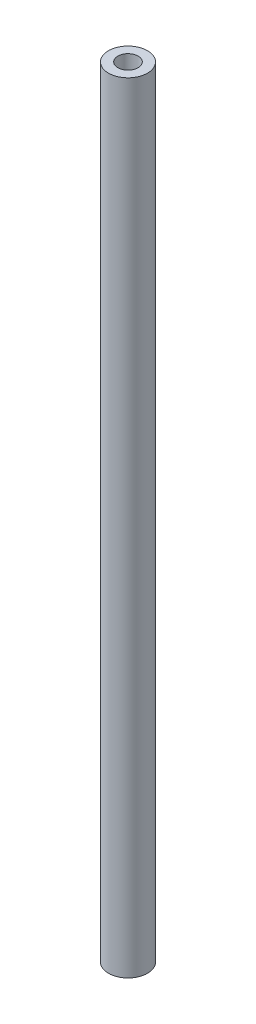
from build123d import *

# Parameters (mm, degrees)
SKETCH1_R           = 5
BOSS_EXTRUDE1_DEPTH = 200
SKETCH2_R           = 2.6
CUT_EXTRUDE1_DEPTH  = 10
CUT_EXTRUDE2_START  = -10
SKETCH3_R           = 2.6
CUT_EXTRUDE2_DEPTH  = 10


with BuildPart() as part:
    # Sketch1 → Boss-Extrude1 (new body)
    with BuildSketch(Plane(origin=(0, 0, 0), x_dir=(1, 0, 0), z_dir=(0, 1, 0))):
        with Locations(Location((0, 0, 0), (0, 0, 270))):
            Circle(SKETCH1_R)
    extrude(amount=BOSS_EXTRUDE1_DEPTH)

    # Sketch2 → Cut-Extrude1 (cut)
    with BuildSketch(Plane.XZ):
        with Locations(Location((0, 0, 0), (0, 0, 270))):
            Circle(SKETCH2_R)
    extrude(amount=-CUT_EXTRUDE1_DEPTH, mode=Mode.SUBTRACT)

    # Sketch3 → Cut-Extrude2 (cut)
    with BuildSketch(Plane(origin=(0, 200, 0), x_dir=(1, 0, 0), z_dir=(0, 1, 0)).offset(CUT_EXTRUDE2_START)):
        with Locations(Location((0, 0, 0), (0, 0, 90))):
            Circle(SKETCH3_R)
    extrude(amount=CUT_EXTRUDE2_DEPTH, mode=Mode.SUBTRACT)


solid = part.part
